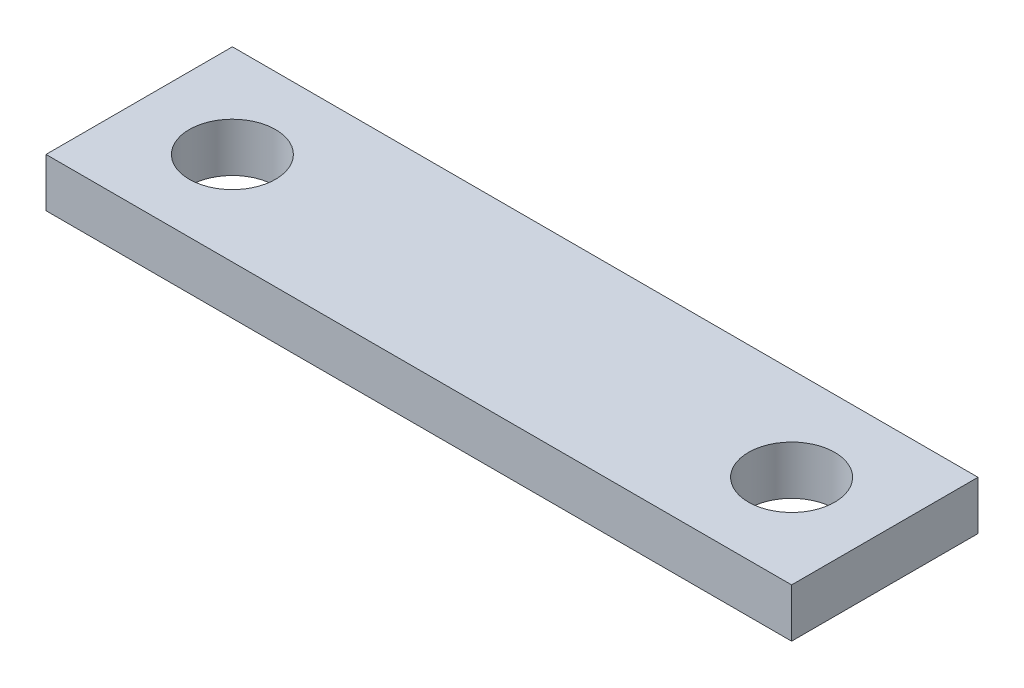
from build123d import *

# Parameters (mm, degrees)
SKETCH1_W           = 24
SKETCH1_H           = 6
SKETCH1_R           = 1.3890625
BOSS_EXTRUDE1_DEPTH = 1.57


with BuildPart() as part:
    # Sketch1 → Boss-Extrude1 (new body)
    with BuildSketch(Plane(origin=(0, 0, 0), x_dir=(1, 0, 0), z_dir=(0, 1, 0))):
        with Locations((12, 3)):
            Rectangle(SKETCH1_W, SKETCH1_H)
        with Locations((3, 3)):
            Circle(SKETCH1_R, mode=Mode.SUBTRACT)
        with Locations((21, 3)):
            Circle(SKETCH1_R, mode=Mode.SUBTRACT)
    extrude(amount=BOSS_EXTRUDE1_DEPTH)


solid = part.part
